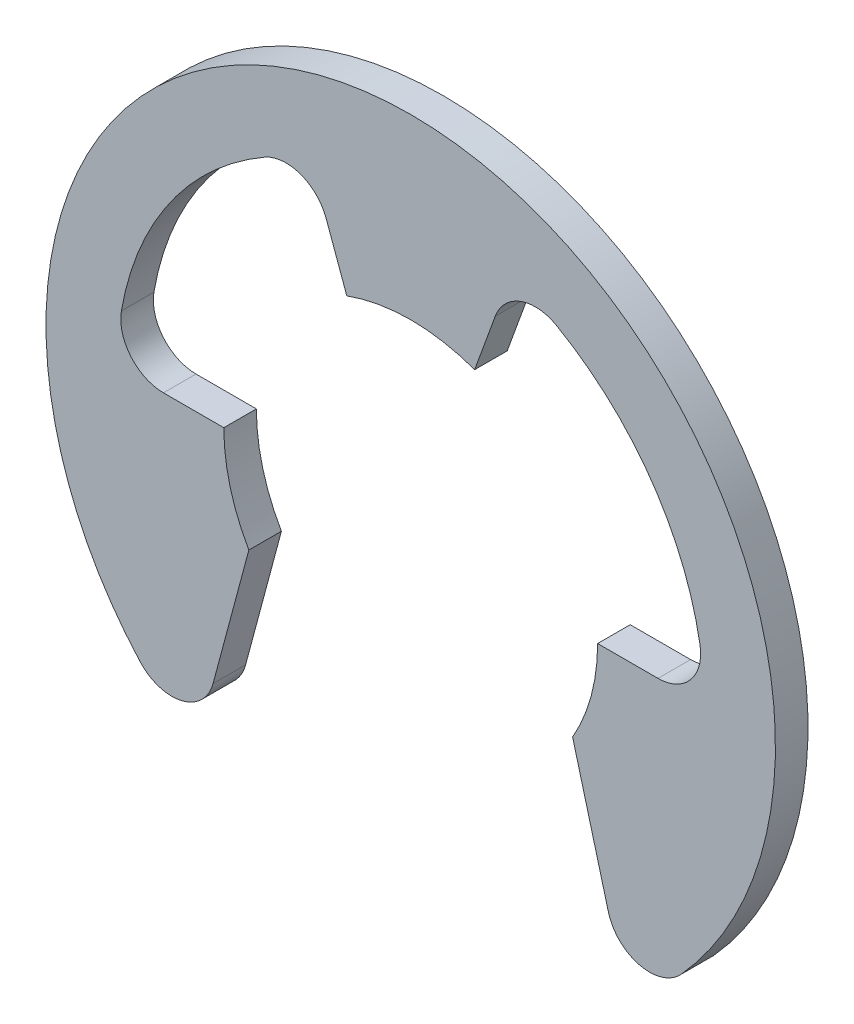
from build123d import *

# Parameters (mm, degrees)
BODY_DEPTH = 1.27


with BuildPart() as part:
    # BodySke → Body (new body)
    with BuildSketch(Plane.XY):
        with BuildLine():
            Line((6.313151989, -3.6449), (7.708939042, -8.854048199))
            ThreePointArc((7.708939042, -8.854048199), (8.92627505, -10.041144917), (10.550895276, -9.539433152))
            ThreePointArc((10.550895276, -9.539433152), (0, 14.224), (-10.550895276, -9.539433152))
            ThreePointArc((-10.550895276, -9.539433152), (-8.92627505, -10.041144917), (-7.708939042, -8.854048199))
            Line((-7.708939042, -8.854048199), (-6.313151989, -3.6449))
            ThreePointArc((-6.313151989, -3.6449), (-7.041406088, -1.886739075), (-7.2898, 0))
            Line((-7.2898, 0), (-9.643567795, 0))
            ThreePointArc((-9.643567795, 0), (-10.91647378, 0.592154541), (-11.283534992, 1.947220116))
            ThreePointArc((-11.283534992, 1.947220116), (-9.379553036, 6.567633741), (-5.68898463, 9.937066065))
            ThreePointArc((-5.68898463, 9.937066065), (-4.290097179, 10.055601075), (-3.298294439, 9.061989495))
            Line((-3.298294439, 9.061989495), (-2.493258441, 6.850171267))
            ThreePointArc((-2.493258441, 6.850171267), (0, 7.2898), (2.493258441, 6.850171267))
            Line((2.493258441, 6.850171267), (3.298294439, 9.061989495))
            ThreePointArc((3.298294439, 9.061989495), (4.290097179, 10.055601075), (5.68898463, 9.937066065))
            ThreePointArc((5.68898463, 9.937066065), (9.379553036, 6.567633741), (11.283534992, 1.947220116))
            ThreePointArc((11.283534992, 1.947220116), (10.91647378, 0.592154541), (9.643567795, 0))
            Line((9.643567795, 0), (7.2898, 0))
            ThreePointArc((7.2898, 0), (7.041406088, -1.886739075), (6.313151989, -3.6449))
        make_face()
    extrude(amount=-BODY_DEPTH)


solid = part.part
